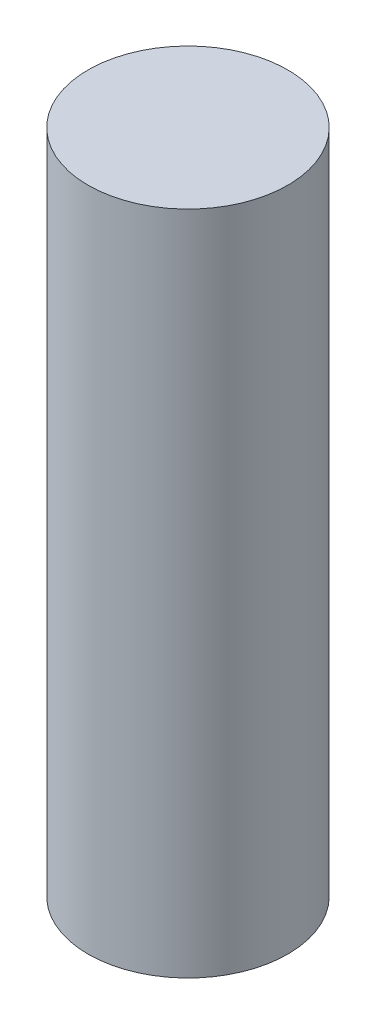
from build123d import *

# Parameters (mm, degrees)
SKETCH1_R           = 2.25
BOSS_EXTRUDE1_DEPTH = 15
SKETCH2_R           = 2
CUT_EXTRUDE1_DEPTH  = 3


with BuildPart() as part:
    # Sketch1 → Boss-Extrude1 (new body)
    with BuildSketch(Plane(origin=(0, 0, 0), x_dir=(1, 0, 0), z_dir=(0, 1, 0))):
        Circle(SKETCH1_R)
    extrude(amount=BOSS_EXTRUDE1_DEPTH)

    # Sketch2 → Cut-Extrude1 (cut)
    with BuildSketch(Plane.XZ):
        Circle(SKETCH2_R)
    extrude(amount=-CUT_EXTRUDE1_DEPTH, mode=Mode.SUBTRACT)


solid = part.part
